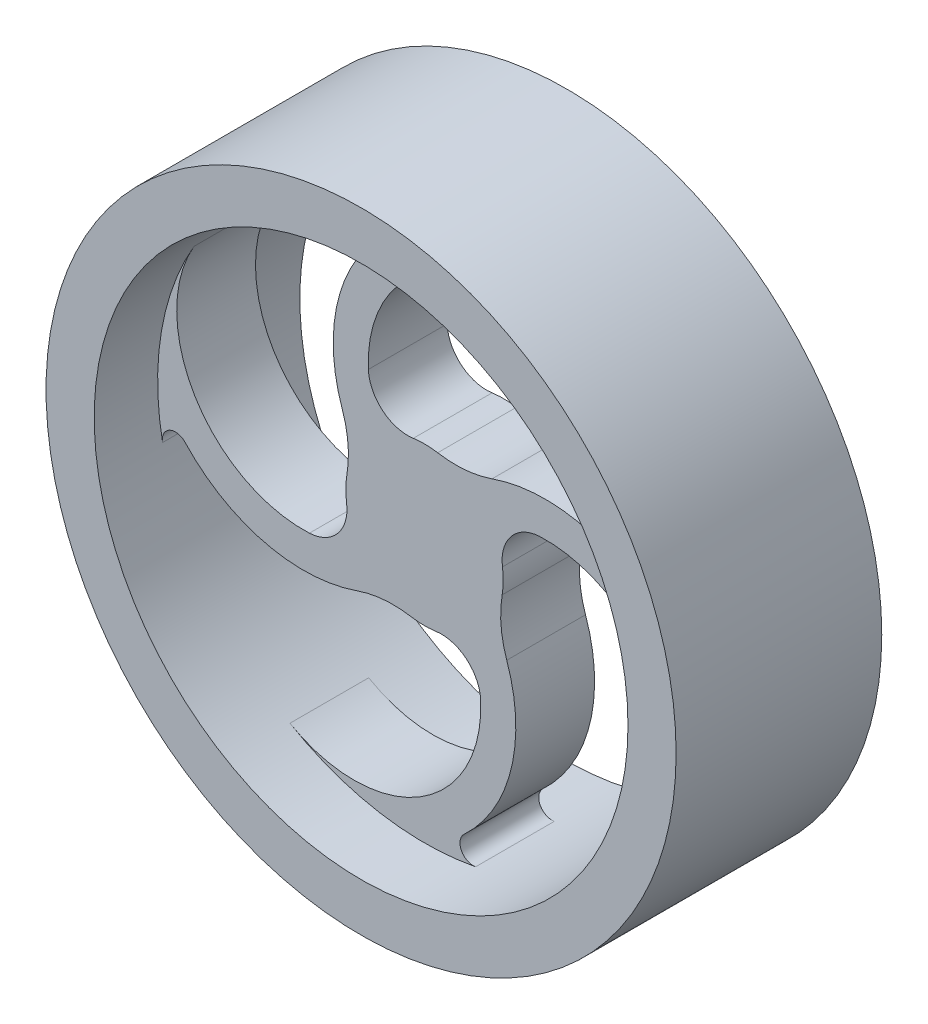
from build123d import *

# Parameters (mm, degrees)
BOSS_EXTRUDE5_DEPTH      = 18
BOSS_EXTRUDE6_DEPTH      = 14.5
BOSS_EXTRUDE6_DEPTH_BACK = 32.5
SKETCH5_R                = 72
SKETCH5_R_2              = 61


with BuildPart() as part:
    # Sketch1 → Boss-Extrude5 (new body)
    with BuildSketch(Plane.XY):
        with BuildLine():
            ThreePointArc((-30.757316719, -52.678149818), (-10.195342734, -60.141956956), (11.677704627, -59.871789807))
            ThreePointArc((11.677704627, -59.871789807), (8.429841492, -58.288205935), (9.060512734, -54.730312371))
            ThreePointArc((9.060512734, -54.730312371), (19.779749173, -36.530020554), (18.79448635, -15.430686222))
            ThreePointArc((18.79448635, -15.430686222), (17.483891441, -9.285507816), (17.746946993, -3.007635689))
            ThreePointArc((17.746946993, -3.007635689), (17.99859257, -0.225089943), (17.816611705, 2.562878725))
            ThreePointArc((17.816611705, 2.562878725), (19.790690206, 9.581605585), (26.315634879, 12.835005296))
            ThreePointArc((26.315634879, 12.835005296), (52.449565984, -1.128017494), (52.67814252, -30.757329218))
            ThreePointArc((52.67814252, -30.757329218), (60.141955689, -10.195350207), (59.871789938, 11.677703954))
            ThreePointArc((59.871789938, 11.677703954), (58.288206152, 8.429840898), (54.730312659, 9.060511918))
            ThreePointArc((54.730312659, 9.060511918), (36.530019461, 19.779748115), (15.430684033, 18.794485892))
            ThreePointArc((15.430684033, 18.794485892), (9.285506382, 17.48389147), (3.007635099, 17.746947093))
            ThreePointArc((3.007635099, 17.746947093), (0.225087357, 17.998592603), (-2.562883253, 17.816611054))
            ThreePointArc((-2.562883253, 17.816611054), (-9.581612202, 19.790686823), (-12.835014333, 26.315631712))
            ThreePointArc((-12.835014333, 26.315631712), (1.128002953, 52.449566526), (30.757315296, 52.678150649))
            ThreePointArc((30.757315296, 52.678150649), (10.195341286, 60.141957202), (-11.677705893, 59.87178956))
            ThreePointArc((-11.677705893, 59.87178956), (-8.429842727, 58.288205762), (-9.060513882, 54.730312188))
            ThreePointArc((-9.060513882, 54.730312188), (-19.779749829, 36.530020233), (-18.794486597, 15.430686052))
            ThreePointArc((-18.794486597, 15.430686052), (-17.48389156, 9.285507447), (-17.746947093, 3.007635099))
            ThreePointArc((-17.746947093, 3.007635099), (-17.998592591, 0.225088317), (-17.816611327, -2.56288135))
            ThreePointArc((-17.816611327, -2.56288135), (-19.790686113, -9.581611967), (-26.315632103, -12.835014885))
            ThreePointArc((-26.315632103, -12.835014885), (-52.44956681, 1.128003994), (-52.678149652, 30.757317003))
            ThreePointArc((-52.678149652, 30.757317003), (-60.141956871, 10.195343235), (-59.871789938, -11.677703952))
            ThreePointArc((-59.871789938, -11.677703952), (-58.288206008, -8.429840823), (-54.73031244, -9.060512152))
            ThreePointArc((-54.73031244, -9.060512152), (-36.530020387, -19.779749225), (-15.430685526, -18.794486492))
            ThreePointArc((-15.430685526, -18.794486492), (-9.285507097, -17.483891569), (-3.007634946, -17.746947119))
            ThreePointArc((-3.007634946, -17.746947119), (-0.225087887, -17.998592596), (2.562882049, -17.816611227))
            ThreePointArc((2.562882049, -17.816611227), (9.581611647, -19.79068664), (12.835014058, -26.315631978))
            ThreePointArc((12.835014058, -26.315631978), (-1.128004083, -52.449566659), (-30.757316719, -52.678149818))
        make_face()
    extrude(amount=-BOSS_EXTRUDE5_DEPTH)

    # Sketch5 → Boss-Extrude6 (add, two sides: drawn at the far end of the back side and taken through both)
    with BuildSketch(Plane.XY.offset(-BOSS_EXTRUDE6_DEPTH_BACK)):
        Circle(SKETCH5_R)
        Circle(SKETCH5_R_2, mode=Mode.SUBTRACT)
    extrude(amount=BOSS_EXTRUDE6_DEPTH + BOSS_EXTRUDE6_DEPTH_BACK)


solid = part.part
